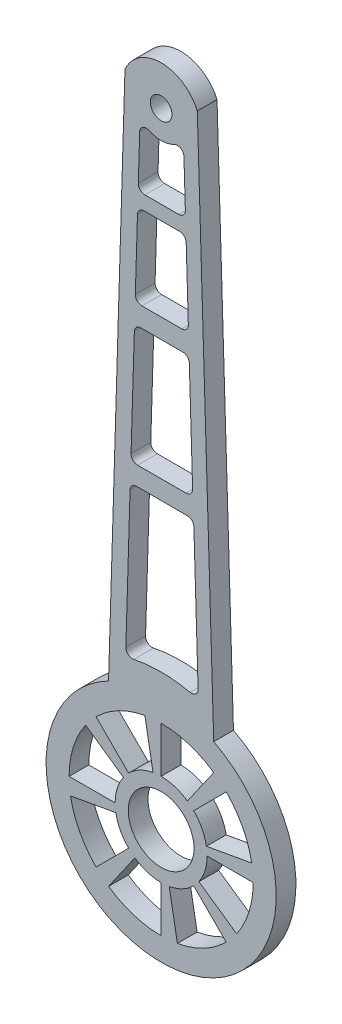
from build123d import *

# Parameters (mm, degrees)
SKETCH_1_R      = 1.65
SKETCH_1_R_2    = 5
EXTRUDE_1_DEPTH = 3
FILLET_1_R      = 1


with BuildPart() as part:
    # 草图1 → 凸台-拉伸1 (new body)
    with BuildSketch(Plane.XY):
        with BuildLine():
            Line((-5.5, 2.397915762), (-8, -79.435617584))
            ThreePointArc((-8, -79.435617584), (0, -112.5), (8, -79.435617584))
            Line((8, -79.435617584), (5.5, 2.397915762))
            ThreePointArc((5.5, 2.397915762), (0, 6), (-5.5, 2.397915762))
        make_face()
        Circle(SKETCH_1_R, mode=Mode.SUBTRACT)
        with Locations((0, -95)):
            Circle(SKETCH_1_R_2, mode=Mode.SUBTRACT)
        with BuildLine():
            Line((-3.203324226, -2.80246125), (-3.504023082, -12.645361196))
            Line((-3.504023082, -12.645361196), (3.713679897, -12.645361196))
            Line((3.713679897, -12.645361196), (3.40536458, -2.553148492))
            ThreePointArc((3.40536458, -2.553148492), (0.16045027, -4.253155401), (-3.203324226, -2.80246125))
        make_face(mode=Mode.SUBTRACT)
        Polygon((-3.570265581, -14.813704302), (-3.957626018, -27.493333612), (4.167282834, -27.493333612), (3.779922396, -14.813704302), align=None, mode=Mode.SUBTRACT)
        Polygon((-4.048518432, -30.468552565), (4.258175248, -30.468552565), (4.818203506, -48.800189025), (-4.60854669, -48.800189025), align=None, mode=Mode.SUBTRACT)
        with BuildLine():
            Line((-4.696319338, -51.673287395), (-5.408181825, -74.974976421))
            ThreePointArc((-5.408181825, -74.974976421), (0.132605518, -74.257955362), (5.66377239, -75.045760292))
            Line((5.66377239, -75.045760292), (4.949747468, -51.673287395))
            Line((4.949747468, -51.673287395), (-4.696319338, -51.673287395))
        make_face(mode=Mode.SUBTRACT)
        with BuildLine():
            Line((0, -81), (0, -88))
            ThreePointArc((0, -88), (2.096194278, -88.321229937), (3.999999882, -89.255437272))
            Line((3.999999882, -89.255437272), (7.999999765, -83.510874543))
            ThreePointArc((7.999999765, -83.510874543), (4.192388556, -81.642459875), (0, -81))
        make_face(mode=Mode.SUBTRACT)
        with BuildLine():
            Line((9.899494937, -85.100505063), (4.949747468, -90.050252532))
            ThreePointArc((4.949747468, -90.050252532), (6.20483679, -91.759629587), (6.890446302, -93.766407781))
            Line((6.890446302, -93.766407781), (13.780892604, -92.532815563))
            ThreePointArc((13.780892604, -92.532815563), (12.40967358, -88.519259175), (9.899494937, -85.100505063))
        make_face(mode=Mode.SUBTRACT)
        with BuildLine():
            Line((14, -95), (7, -95))
            ThreePointArc((7, -95), (6.678770063, -97.096194278), (5.744562728, -98.999999882))
            Line((5.744562728, -98.999999882), (11.489125457, -102.999999765))
            ThreePointArc((11.489125457, -102.999999765), (13.357540125, -99.192388556), (14, -95))
        make_face(mode=Mode.SUBTRACT)
        with BuildLine():
            Line((9.899494937, -104.899494937), (4.949747468, -99.949747468))
            ThreePointArc((4.949747468, -99.949747468), (3.240370413, -101.20483679), (1.233592219, -101.890446302))
            Line((1.233592219, -101.890446302), (2.467184437, -108.780892604))
            ThreePointArc((2.467184437, -108.780892604), (6.480740825, -107.40967358), (9.899494937, -104.899494937))
        make_face(mode=Mode.SUBTRACT)
        with BuildLine():
            Line((0, -109), (0, -102))
            ThreePointArc((0, -102), (-2.096194278, -101.678770063), (-3.999999882, -100.744562728))
            Line((-3.999999882, -100.744562728), (-7.999999765, -106.489125457))
            ThreePointArc((-7.999999765, -106.489125457), (-4.192388556, -108.357540125), (0, -109))
        make_face(mode=Mode.SUBTRACT)
        with BuildLine():
            Line((-9.899494937, -104.899494937), (-4.949747468, -99.949747468))
            ThreePointArc((-4.949747468, -99.949747468), (-6.20483679, -98.240370413), (-6.890446302, -96.233592219))
            Line((-6.890446302, -96.233592219), (-13.780892604, -97.467184437))
            ThreePointArc((-13.780892604, -97.467184437), (-12.40967358, -101.480740825), (-9.899494937, -104.899494937))
        make_face(mode=Mode.SUBTRACT)
        with BuildLine():
            Line((-14, -95), (-7, -95))
            ThreePointArc((-7, -95), (-6.678770063, -92.903805722), (-5.744562728, -91.000000118))
            Line((-5.744562728, -91.000000118), (-11.489125457, -87.000000235))
            ThreePointArc((-11.489125457, -87.000000235), (-13.357540125, -90.807611444), (-14, -95))
        make_face(mode=Mode.SUBTRACT)
        with BuildLine():
            Line((-9.899494937, -85.100505063), (-4.949747468, -90.050252532))
            ThreePointArc((-4.949747468, -90.050252532), (-3.240370413, -88.79516321), (-1.233592219, -88.109553698))
            Line((-1.233592219, -88.109553698), (-2.467184437, -81.219107396))
            ThreePointArc((-2.467184437, -81.219107396), (-6.480740825, -82.59032642), (-9.899494937, -85.100505063))
        make_face(mode=Mode.SUBTRACT)
    extrude(amount=EXTRUDE_1_DEPTH)

    # 圆角1
    fillet_1_edges = [part.edges().sort_by_distance(p)[0] for p in [
        (3.40536458, -2.553148492, 1.5),
        (-3.203324226, -2.80246125, 1.5),
        (-3.504023082, -12.645361196, 1.5),
        (3.713679897, -12.645361196, 1.5),
        (-5.408181825, -74.974976421, 1.5),
        (5.66377239, -75.045760292, 1.5),
        (4.949747468, -51.673287395, 1.5),
        (-4.696319338, -51.673287395, 1.5),
        (3.779922396, -14.813704302, 1.5),
        (-3.570265581, -14.813704302, 1.5),
        (-3.957626018, -27.493333612, 1.5),
        (4.167282834, -27.493333612, 1.5),
        (-4.048518432, -30.468552565, 1.5),
        (-4.60854669, -48.800189025, 1.5),
        (4.818203506, -48.800189025, 1.5),
        (4.258175248, -30.468552565, 1.5),
    ]]
    fillet(fillet_1_edges, radius=FILLET_1_R)


solid = part.part
